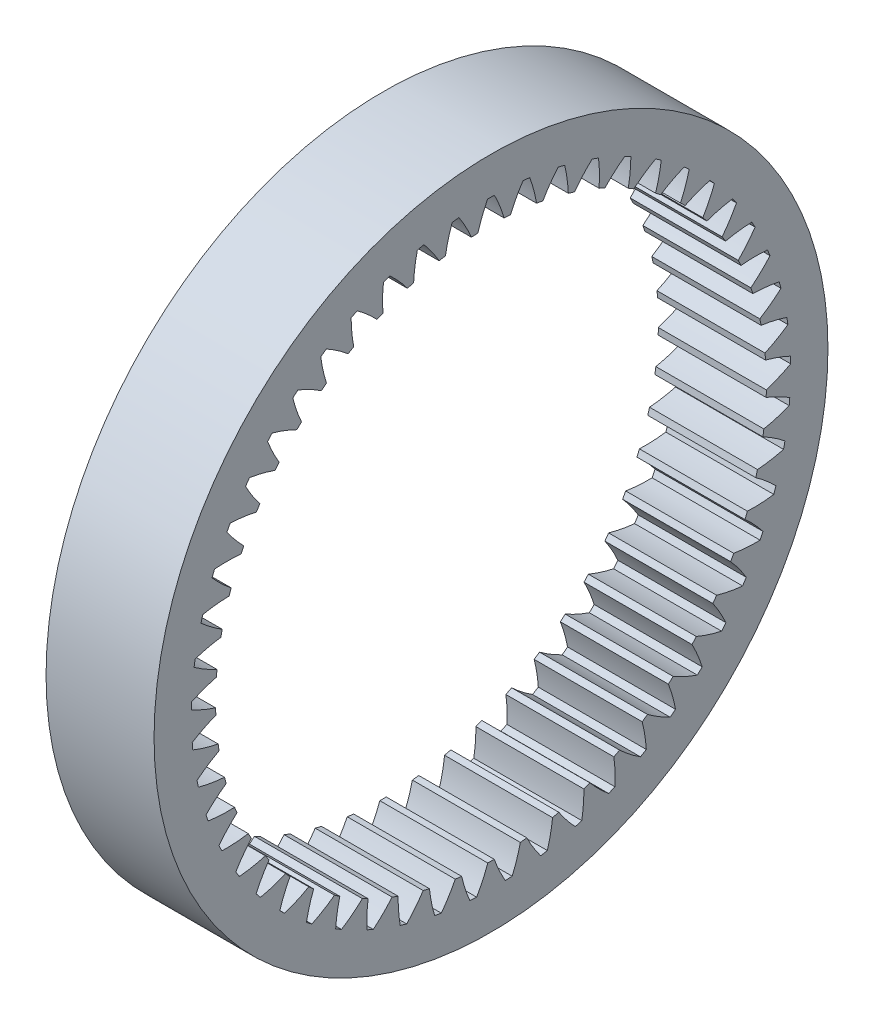
from build123d import *

# Parameters (mm, degrees)
BASPROSKE_W     = 25
BASPROSKE_H     = 14.25
TOOTHCUT_DEPTH  = 114.106144837
TEETHCUTS_COUNT = 53


with BuildPart() as part:
    # BasProSke → Base-Revolve (revolve)
    with BuildSketch(Plane(origin=(0, 0, 0), x_dir=(1, 0, 0), z_dir=(0, 1, 0)), mode=Mode.PRIVATE) as base_revolve_sk:
        with Locations((12.5, 70.875)):
            Rectangle(BASPROSKE_W, BASPROSKE_H)
    revolve(base_revolve_sk.sketch.rotate(Axis((-10, 0, 0), (1, 0, 0)), 180), axis=Axis((-10, 0, 0), (1, 0, 0)))

    # TooCutSke → ToothCut (cut, through all)
    with BuildSketch(Plane(origin=(0, 0, 0), x_dir=(0, 0, -1), z_dir=(1, 0, 0))):
        with BuildLine():
            ThreePointArc((3.038935445, 63.652097503), (2.045030054, 66.564222548), (0.785190285, 69.371556507))
            ThreePointArc((0.785190285, 69.371556507), (0, 69.376), (-0.785190285, 69.371556507))
            ThreePointArc((-0.785190285, 69.371556507), (-2.045030054, 66.564222548), (-3.038935445, 63.652097503))
            ThreePointArc((-3.038935445, 63.652097503), (0, 63.7246), (3.038935445, 63.652097503))
        make_face()
    toothcut = extrude(amount=TOOTHCUT_DEPTH, mode=Mode.SUBTRACT)

    # TeethCuts: ToothCut ×53 about axis
    teethcuts_axis = Axis((0, 0, 0), (1, 0, 0))
    for i in range(1, TEETHCUTS_COUNT):
        add(toothcut.rotate(teethcuts_axis, i * 360 / TEETHCUTS_COUNT), mode=Mode.SUBTRACT)


solid = part.part
